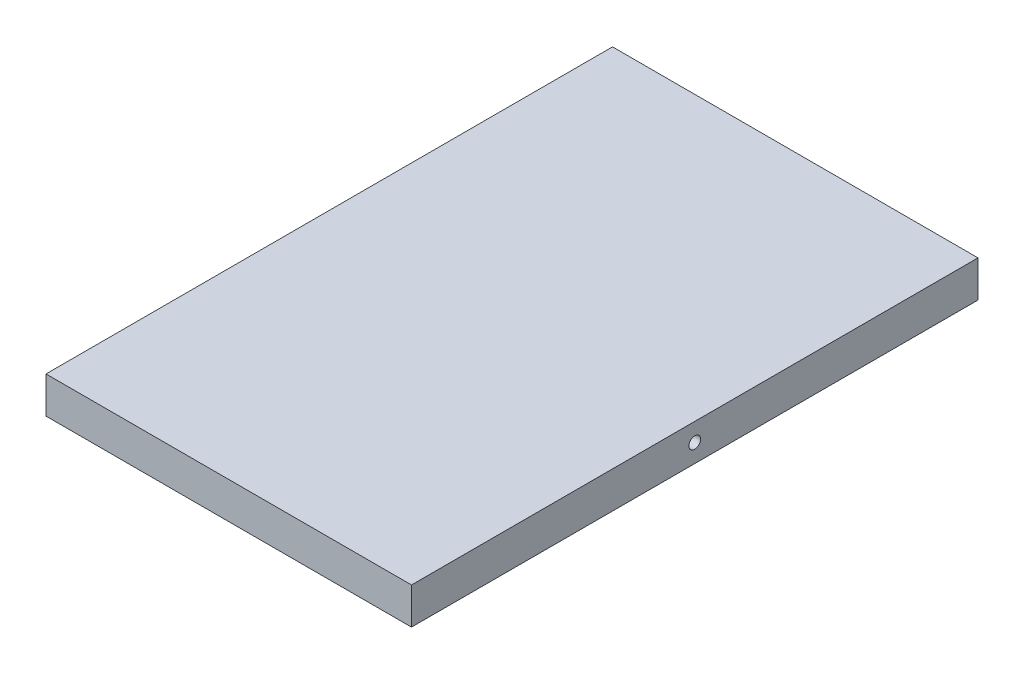
from build123d import *

# Parameters (mm, degrees)
SKETCH1_W           = 500
SKETCH1_H           = 775
BOSS_EXTRUDE1_DEPTH = 50
SKETCH2_R           = 8
CUT_EXTRUDE1_DEPTH  = 45
CUT_EXTRUDE2_START  = -45
SKETCH3_R           = 8
CUT_EXTRUDE2_DEPTH  = 45
SKETCH4_R           = 66.548277476
BOSS_EXTRUDE2_DEPTH = 60.75
FILLET1_R           = 60


with BuildPart() as part:
    # Sketch1 → Boss-Extrude1 (new body)
    with BuildSketch(Plane(origin=(0, 0, 0), x_dir=(1, 0, 0), z_dir=(0, 1, 0))):
        with Locations((250, 387.5)):
            Rectangle(SKETCH1_W, SKETCH1_H)
    extrude(amount=BOSS_EXTRUDE1_DEPTH)

    # Sketch2 → Cut-Extrude1 (cut)
    with BuildSketch(Plane(origin=(500, 0, 0), x_dir=(0, 0, -1), z_dir=(1, 0, 0))):
        with Locations((387.5, 25)):
            Circle(SKETCH2_R)
    extrude(amount=-CUT_EXTRUDE1_DEPTH, mode=Mode.SUBTRACT)

    # Sketch3 → Cut-Extrude2 (cut)
    with BuildSketch(Plane.ZY.offset(CUT_EXTRUDE2_START)):
        with Locations(Location((-387.5, 25, 0), (0, 0, 180))):
            Circle(SKETCH3_R)
    extrude(amount=CUT_EXTRUDE2_DEPTH, mode=Mode.SUBTRACT)

    # Sketch4 → Boss-Extrude2 (add)
    with BuildSketch(Plane(origin=(0, 0, 0), x_dir=(-1, 0, 0), z_dir=(0, -1, 0))):
        with Locations(Location((-250, 100, 0), (0, 0, 90))):
            Circle(SKETCH4_R)
    extrude(amount=BOSS_EXTRUDE2_DEPTH)

    # Fillet1
    fillet1_edges = [part.edges().sort_by_distance(p)[0] for p in [
        (250, -60.75, -33.451722524),
    ]]
    fillet(fillet1_edges, radius=FILLET1_R)


solid = part.part
